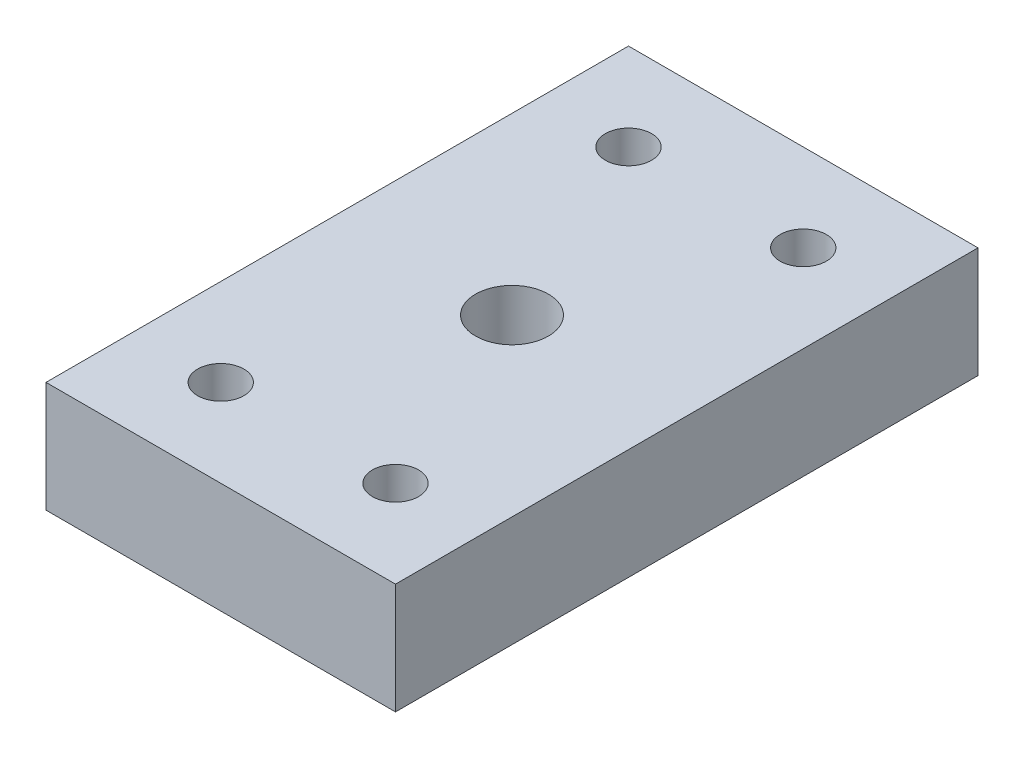
from build123d import *

# Parameters (mm, degrees)
SKETCH1_W                    = 76.2
SKETCH1_H                    = 127
BOSS_EXTRUDE1_DEPTH          = 24.13
SKETCH2_R                    = 7.9375
F_1_2_13_THREADED_HOLE_DEPTH = 78.885280381
SKETCH3_R                    = 5.0419
F_3_8_THROUGH_HOLES_DEPTH    = 78.885280381


with BuildPart() as part:
    # Sketch1 → Boss-Extrude1 (new body)
    with BuildSketch(Plane(origin=(0, 0, 0), x_dir=(1, 0, 0), z_dir=(0, 1, 0))):
        Rectangle(SKETCH1_W, SKETCH1_H)
    extrude(amount=BOSS_EXTRUDE1_DEPTH)

    # Sketch2 → 1/2"-13 Threaded Hole (cut, through all)
    with BuildSketch(Plane(origin=(0, 24.13, 0), x_dir=(1, 0, 0), z_dir=(0, 1, 0))):
        with Locations(Location((0, 0, 0), (0, 0, 270))):
            Circle(SKETCH2_R)
    extrude(amount=-F_1_2_13_THREADED_HOLE_DEPTH, mode=Mode.SUBTRACT)

    # Sketch3 → 3/8" Through Holes (cut, through all)
    with BuildSketch(Plane(origin=(0, 24.13, 0), x_dir=(1, 0, 0), z_dir=(0, 1, 0))):
        with Locations(Location((-19.05, 44.45, 0), (0, 0, 270))):
            Circle(SKETCH3_R)
        with Locations(Location((19.05, 44.45, 0), (0, 0, 270))):
            Circle(SKETCH3_R)
        with Locations(Location((19.05, -44.45, 0), (0, 0, 270))):
            Circle(SKETCH3_R)
        with Locations(Location((-19.05, -44.45, 0), (0, 0, 270))):
            Circle(SKETCH3_R)
    extrude(amount=-F_3_8_THROUGH_HOLES_DEPTH, mode=Mode.SUBTRACT)


solid = part.part
